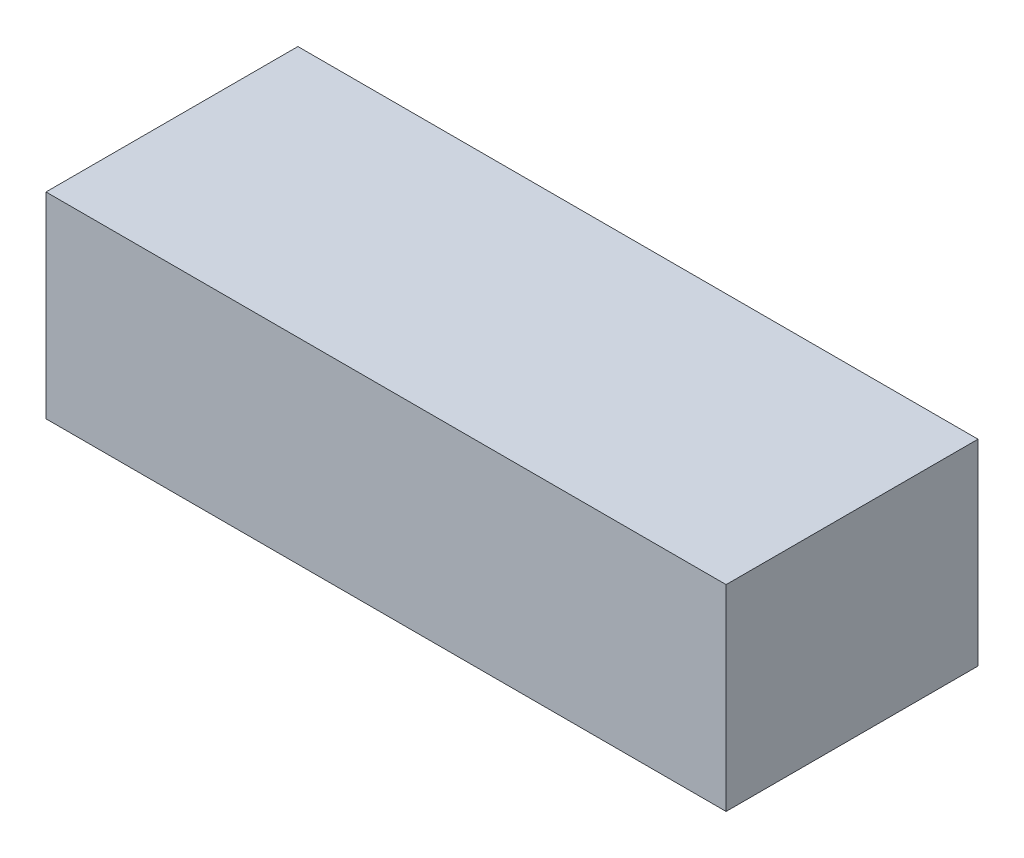
from build123d import *

# Parameters (mm, degrees)
SKETCH_1_W      = 50
SKETCH_1_H      = 39
EXTRUDE_1_DEPTH = 135


with BuildPart() as part:
    # 草图1 → 凸台-拉伸1 (new body)
    with BuildSketch(Plane(origin=(0, 0, 0), x_dir=(0, 0, -1), z_dir=(1, 0, 0))):
        Rectangle(SKETCH_1_W, SKETCH_1_H)
    extrude(amount=EXTRUDE_1_DEPTH)


solid = part.part
